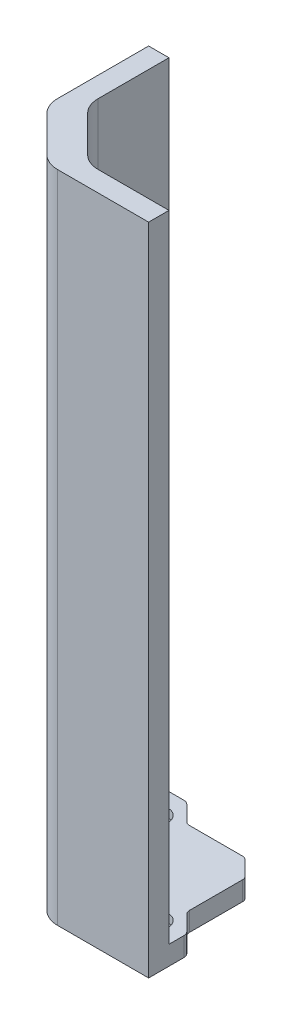
from build123d import *

# Parameters (mm, degrees)
BOSS_EXTRUDE1_DEPTH                                  = 7.5
FILLET1_R                                            = 2.5
BOSS_EXTRUDE2_DEPTH                                  = 250
CHAMFER1_SIZE                                        = 20
FILLET2_R                                            = 10
SKETCH3_R                                            = 2.7
CUT_EXTRUDE1_DEPTH                                   = 265.007575649
REFRENTADO_PARA_TORNILLO_CON_CABEZA_PLAN_D           = 5.3
REFRENTADO_PARA_TORNILLO_CON_CABEZA_PLAN_CBORE_D     = 10
REFRENTADO_PARA_TORNILLO_CON_CABEZA_PLAN_CBORE_DEPTH = 3.3


with BuildPart() as part:
    # Sketch1 → Boss-Extrude1 (new body)
    with BuildSketch(Plane(origin=(0, 0, 0), x_dir=(1, 0, 0), z_dir=(0, 1, 0))):
        Polygon((0, 0), (0, 60), (15, 60), (22.5, 52.5), (45.428932188, 52.5), (52.5, 45.428932188), (52.5, 22.5), (60, 15), (60, 0), align=None)
    extrude(amount=BOSS_EXTRUDE1_DEPTH)

    # Fillet1
    fillet1_edges = [part.edges().sort_by_distance(p)[0] for p in [
        (15, 3.75, -60),
        (22.5, 3.75, -52.5),
        (45.428932188, 3.75, -52.5),
        (52.5, 3.75, -45.428932188),
        (52.5, 3.75, -22.5),
        (60, 3.75, -15),
    ]]
    fillet(fillet1_edges, radius=FILLET1_R)

    # Sketch2 → Boss-Extrude2 (add)
    with BuildSketch(Plane(origin=(0, 7.5, 0), x_dir=(1, 0, 0), z_dir=(0, 1, 0))):
        Polygon((0, 60), (0, 0), (60, 0), (60, 8), (8, 8), (8, 60), align=None)
    extrude(amount=BOSS_EXTRUDE2_DEPTH)

    # Chamfer1
    chamfer1_edges = [part.edges().sort_by_distance(p)[0] for p in [
        (0, 128.75, 0),
        (8, 132.5, -8),
    ]]
    chamfer(chamfer1_edges, length=CHAMFER1_SIZE)

    # Fillet2
    fillet2_edges = [part.edges().sort_by_distance(p)[0] for p in [
        (20, 128.75, 0),
        (0, 128.75, -20),
        (8, 132.5, -28),
        (28, 132.5, -8),
    ]]
    fillet(fillet2_edges, radius=FILLET2_R)

    # Sketch3 → Cut-Extrude1 (cut, through all)
    with BuildSketch(Plane(origin=(0, 7.5, 0), x_dir=(1, 0, 0), z_dir=(0, 1, 0))):
        with Locations(Location((36.6, 13.4, 0), (0, 0, 270))):
            Circle(SKETCH3_R)
        with Locations(Location((49.187905991, 13.4, 0), (0, 0, 270))):
            Circle(SKETCH3_R)
        with Locations(Location((13.4, 49.187905991, 0), (0, 0, 90))):
            Circle(SKETCH3_R)
        with Locations(Location((13.4, 36.6, 0), (0, 0, 90))):
            Circle(SKETCH3_R)
    extrude(amount=-CUT_EXTRUDE1_DEPTH, mode=Mode.SUBTRACT)

    # Refrentado para tornillo con cabeza plana de M51 (through all)
    with Locations(Plane(origin=(0, 7.5, 0), x_dir=(1, 0, 0), z_dir=(0, 1, 0))):
        with Locations((13.4, 49.187905991), (13.4, 36.6), (36.6, 13.4), (49.187905991, 13.4)):
            CounterBoreHole(REFRENTADO_PARA_TORNILLO_CON_CABEZA_PLAN_D / 2, REFRENTADO_PARA_TORNILLO_CON_CABEZA_PLAN_CBORE_D / 2, REFRENTADO_PARA_TORNILLO_CON_CABEZA_PLAN_CBORE_DEPTH)


solid = part.part
